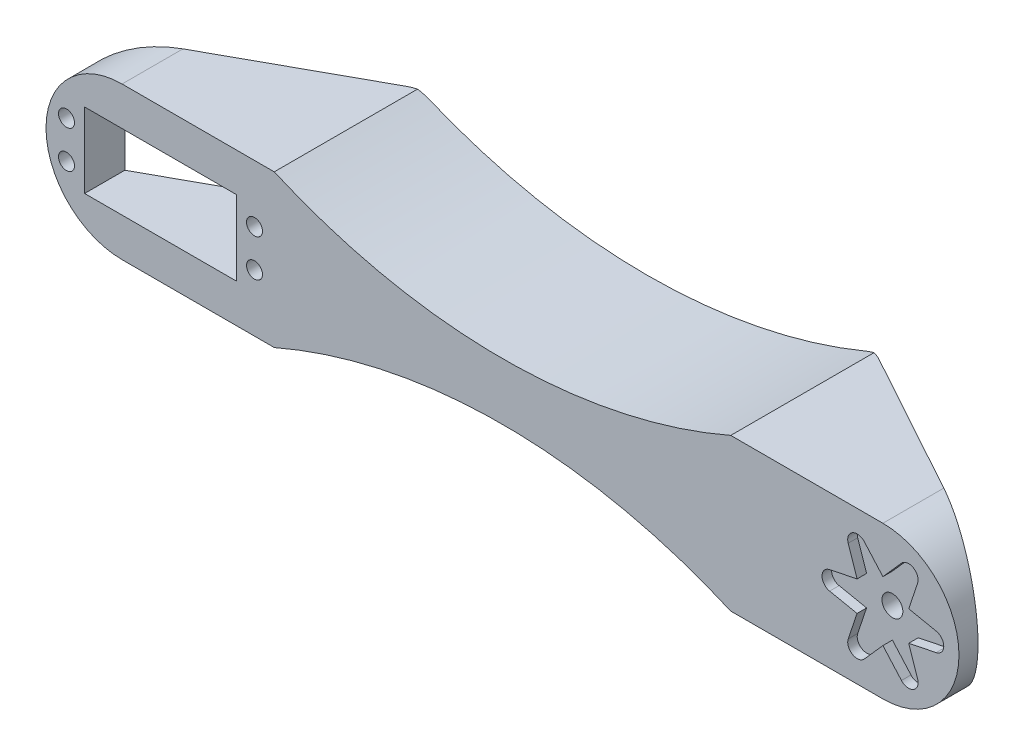
from build123d import *

# Parameters (mm, degrees)
SKETCH1_R           = 2.73935274
BOSS_EXTRUDE1_DEPTH = 60
SKETCH16_R          = 2.1
SKETCH16_W          = 39.9
SKETCH16_H          = 19.7
CUT_EXTRUDE9_DEPTH  = 158.954623162
CUT_EXTRUDE11_DEPTH = 159.304157008
SKETCH19_W          = 123.088854382
SKETCH19_H          = 22
CUT_EXTRUDE12_DEPTH = 159.304157008
CUT_EXTRUDE14_DEPTH = 151.975703271
FILLET3_R           = 10
FILLET4_R           = 10
CUT_EXTRUDE15_DEPTH = 2.5


with BuildPart() as part:
    # Sketch1 → Boss-Extrude1 (new body)
    with BuildSketch(Plane.XY):
        with BuildLine():
            Line((-79.073756432, 38.59348199), (120.926243568, 38.59348199))
            ThreePointArc((120.926243568, 38.59348199), (140.926243568, 18.59348199), (120.926243568, -1.40651801))
            Line((120.926243568, -1.40651801), (-79.073756432, -1.40651801))
            ThreePointArc((-79.073756432, -1.40651801), (-99.073756432, 18.59348199), (-79.073756432, 38.59348199))
        make_face()
        with Locations((-79.073756432, 18.59348199)):
            Circle(SKETCH1_R, mode=Mode.SUBTRACT)
        with Locations((120.926243568, 18.59348199)):
            Circle(SKETCH1_R, mode=Mode.SUBTRACT)
    extrude(amount=BOSS_EXTRUDE1_DEPTH)

    # Sketch16 → Cut-Extrude9 (cut, through all)
    with BuildSketch(Plane.XY.offset(60)):
        with Locations((-93.68490205, 23.51848199)):
            Circle(SKETCH16_R)
        with Locations((-93.68490205, 13.66848199)):
            Circle(SKETCH16_R)
        with Locations((-44.262610814, 23.51848199)):
            Circle(SKETCH16_R)
        with Locations((-44.262610814, 13.66848199)):
            Circle(SKETCH16_R)
        with Locations((-68.973756432, 18.59348199)):
            Rectangle(SKETCH16_W, SKETCH16_H)
    extrude(amount=-CUT_EXTRUDE9_DEPTH, mode=Mode.SUBTRACT)

    # Sketch18 → Cut-Extrude11 (cut, through all)
    with BuildSketch(Plane(origin=(0, -1.40651801, 0), x_dir=(-1, 0, 0), z_dir=(0, -1, 0))):
        Polygon((-140.926243568, -55), (-140.926243568, 0), (-40.926243568, 0), align=None)
        Polygon((99.073756432, -55), (99.073756432, 0), (-0.926243568, 0), align=None)
    extrude(amount=-CUT_EXTRUDE11_DEPTH, mode=Mode.SUBTRACT)

    # Sketch19 → Cut-Extrude12 (cut, through all)
    with BuildSketch(Plane(origin=(0, -1.40651801, 0), x_dir=(-1, 0, 0), z_dir=(0, -1, 0))):
        with Locations((-19.381816377, -11)):
            Rectangle(SKETCH19_W, SKETCH19_H)
    extrude(amount=-CUT_EXTRUDE12_DEPTH, mode=Mode.SUBTRACT)

    # Sketch22 → Cut-Extrude14 (cut, through all)
    with BuildSketch(Plane(origin=(0, 0, 22), x_dir=(-1, 0, 0), z_dir=(0, 0, -1))):
        with BuildLine():
            Line((-80.926243568, 38.59348199), (39.073756432, 38.59348199))
            ThreePointArc((39.073756432, 38.59348199), (-20.926243568, 26.070752838), (-80.926243568, 38.59348199))
        make_face()
        with BuildLine():
            Line((-80.926243568, -1.40651801), (39.073756432, -1.40651801))
            ThreePointArc((39.073756432, -1.40651801), (-20.926243568, 11.116211141), (-80.926243568, -1.40651801))
        make_face()
    extrude(amount=-CUT_EXTRUDE14_DEPTH, mode=Mode.SUBTRACT)

    # Fillet3
    fillet3_edges = [part.edges().sort_by_distance(p)[0] for p in [
        (80.926243568, 18.59348199, 22),
    ]]
    fillet(fillet3_edges, radius=FILLET3_R)

    # Fillet4
    fillet4_edges = [part.edges().sort_by_distance(p)[0] for p in [
        (-39.073756432, 18.59348199, 22),
    ]]
    fillet(fillet4_edges, radius=FILLET4_R)

    # Sketch23 → Cut-Extrude15 (cut)
    with BuildSketch(Plane.XY.offset(60)):
        with BuildLine():
            Line((116.047109388, 31.94309545), (120.926243568, 26.438441465))
            Line((120.926243568, 26.438441465), (125.805377748, 31.94309545))
            ThreePointArc((125.805377748, 31.94309545), (128.926243568, 32.44988845), (130.047780865, 29.493742868))
            Line((130.047780865, 29.493742868), (127.720177765, 22.515961727))
            Line((127.720177765, 22.515961727), (134.926915045, 21.042834572))
            ThreePointArc((134.926915045, 21.042834572), (136.926243568, 18.59348199), (134.926915045, 16.144129408))
            Line((134.926915045, 16.144129408), (127.720177765, 14.671002252))
            Line((127.720177765, 14.671002252), (130.047780865, 7.693221111))
            ThreePointArc((130.047780865, 7.693221111), (128.926243568, 4.737075529), (125.805377748, 5.243868529))
            Line((125.805377748, 5.243868529), (120.926243568, 10.748522514))
            Line((120.926243568, 10.748522514), (116.047109388, 5.243868529))
            ThreePointArc((116.047109388, 5.243868529), (112.926243568, 4.737075529), (111.80470627, 7.693221111))
            Line((111.80470627, 7.693221111), (114.13230937, 14.671002252))
            Line((114.13230937, 14.671002252), (106.92557209, 16.144129408))
            ThreePointArc((106.92557209, 16.144129408), (104.926243568, 18.59348199), (106.92557209, 21.042834572))
            Line((106.92557209, 21.042834572), (114.13230937, 22.515961727))
            Line((114.13230937, 22.515961727), (111.80470627, 29.493742868))
            ThreePointArc((111.80470627, 29.493742868), (112.926243568, 32.44988845), (116.047109388, 31.94309545))
        make_face()
    extrude(amount=-CUT_EXTRUDE15_DEPTH, mode=Mode.SUBTRACT)


solid = part.part
